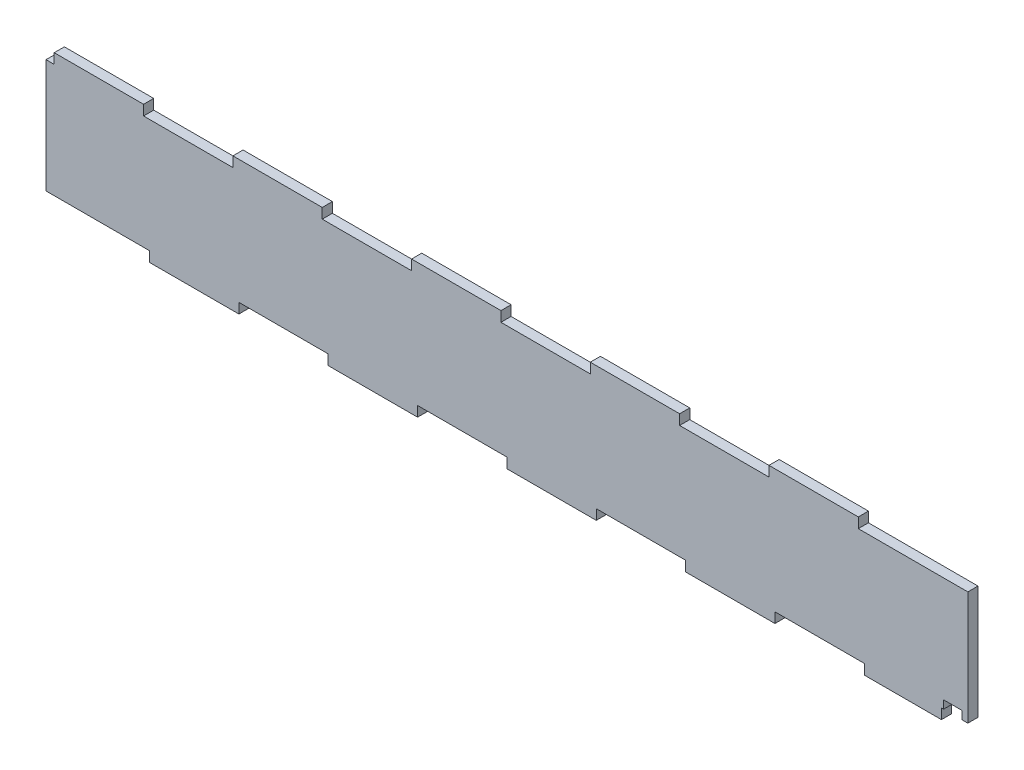
from build123d import *

# Parameters (mm, degrees)
BOSS_EXTRUDE1_DEPTH = 5


with BuildPart() as part:
    # Sketch1 → Boss-Extrude1 (new body)
    with BuildSketch(Plane.XY):
        Polygon((305.05, 56), (349.05, 56), (349.05, 61), (393.05, 61), (393.05, 56), (447, 56), (447, 0), (444.06, 0), (444.06, 4), (435.06, 4), (435.06, 0), (434, 0), (434, -5), (396, -5), (396, 0), (352, 0), (352, -5), (308, -5), (308, 0), (264, 0), (264, -5), (220, -5), (220, 0), (176, 0), (176, -5), (132, -5), (132, 0), (88, 0), (88, -5), (44, -5), (44, 0), (0, 0), (-7, 0), (-7, 56), (-2.95, 56), (-2.95, 61), (41.05, 61), (41.05, 56), (85.05, 56), (85.05, 61), (129.05, 61), (129.05, 56), (173.05, 56), (173.05, 61), (217.05, 61), (217.05, 56), (261.05, 56), (261.05, 61), (305.05, 61), align=None)
    extrude(amount=BOSS_EXTRUDE1_DEPTH)


solid = part.part
